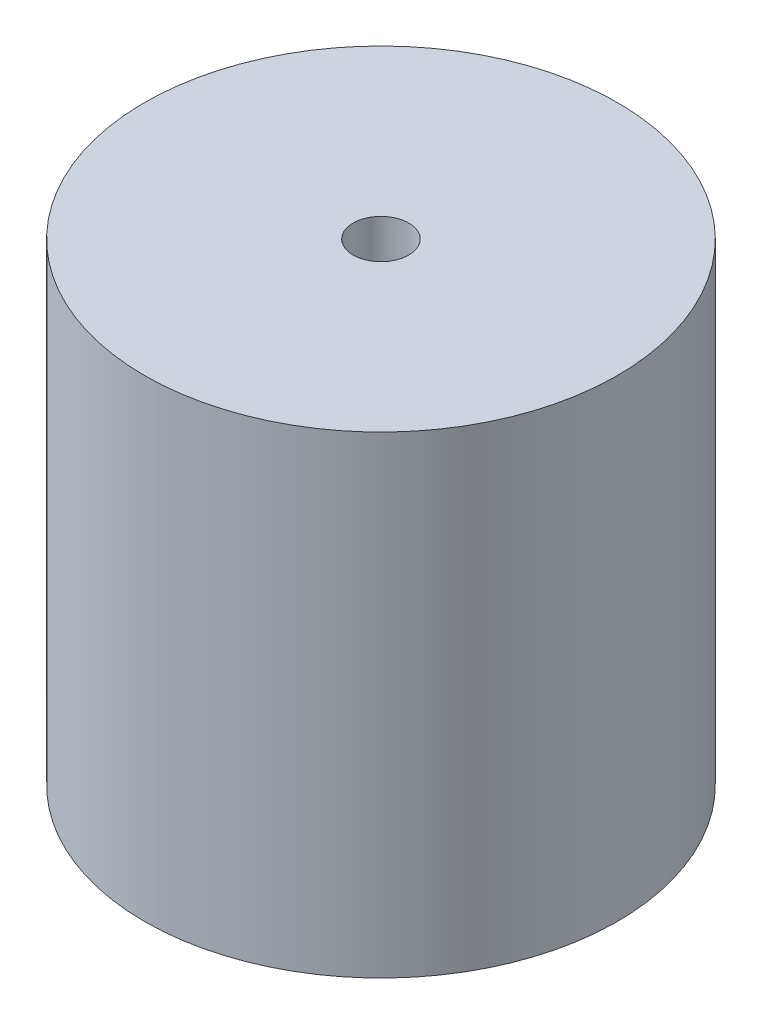
from build123d import *

# Parameters (mm, degrees)
SKETCH1_R           = 10
BOSS_EXTRUDE1_DEPTH = 20
SKETCH2_R           = 1.175
CUT_EXTRUDE1_DEPTH  = 20
SKETCH3_R           = 2.45
CUT_EXTRUDE2_DEPTH  = 15


with BuildPart() as part:
    # Sketch1 → Boss-Extrude1 (new body)
    with BuildSketch(Plane(origin=(0, 0, 0), x_dir=(1, 0, 0), z_dir=(0, 1, 0))):
        with Locations(Location((0, 0, 0), (0, 0, 270))):
            Circle(SKETCH1_R)
    extrude(amount=BOSS_EXTRUDE1_DEPTH)

    # Sketch2 → Cut-Extrude1 (cut)
    with BuildSketch(Plane(origin=(0, 20, 0), x_dir=(1, 0, 0), z_dir=(0, 1, 0))):
        with Locations(Location((0, 0, 0), (0, 0, 270))):
            Circle(SKETCH2_R)
    extrude(amount=-CUT_EXTRUDE1_DEPTH, mode=Mode.SUBTRACT)

    # Sketch3 → Cut-Extrude2 (cut)
    with BuildSketch(Plane(origin=(0, 0, 0), x_dir=(-1, 0, 0), z_dir=(0, -1, 0))):
        with Locations(Location((0, 0, 0), (0, 0, 90))):
            Circle(SKETCH3_R)
    extrude(amount=-CUT_EXTRUDE2_DEPTH, mode=Mode.SUBTRACT)


solid = part.part
